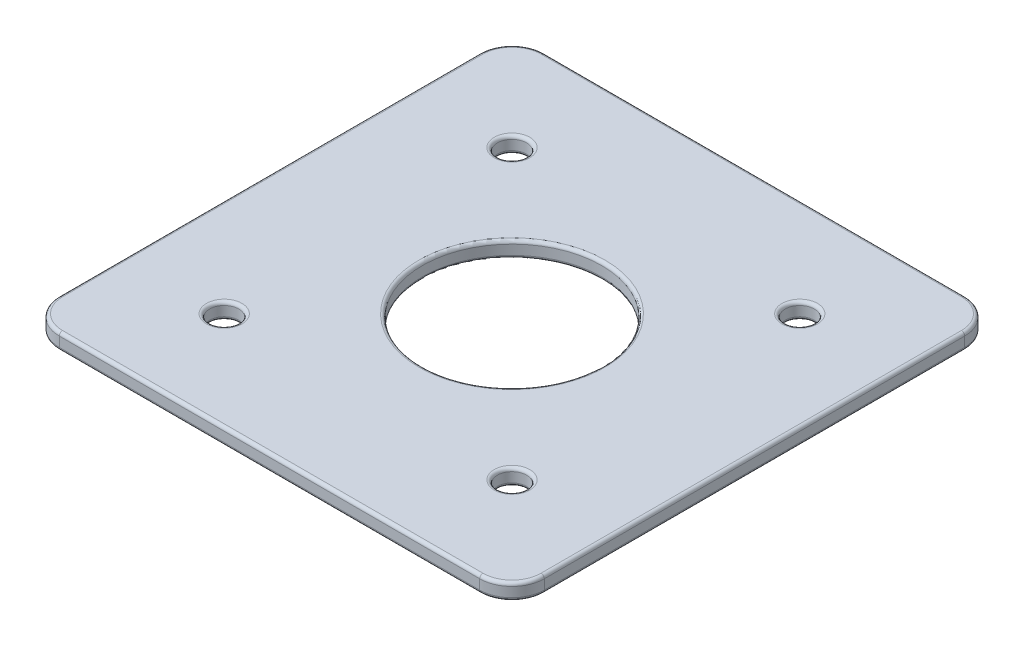
from build123d import *

# Parameters (mm, degrees)
SKETCH1_W           = 150
SKETCH1_H           = 150
SKETCH1_R           = 27.75
BOSS_EXTRUDE1_DEPTH = 5
SKETCH2_R           = 4.5
CUT_EXTRUDE1_DEPTH  = 5
FILLET1_R           = 10
FILLET2_R           = 1


with BuildPart() as part:
    # Sketch1 → Boss-Extrude1 (new body)
    with BuildSketch(Plane(origin=(0, 0, 0), x_dir=(1, 0, 0), z_dir=(0, 1, 0))):
        Rectangle(SKETCH1_W, SKETCH1_H)
        with Locations(Location((0, 0, 0), (0, 0, 270))):
            Circle(SKETCH1_R, mode=Mode.SUBTRACT)
    extrude(amount=-BOSS_EXTRUDE1_DEPTH)

    # Sketch2 → Cut-Extrude1 (cut)
    with BuildSketch(Plane(origin=(0, 0, 0), x_dir=(1, 0, 0), z_dir=(0, 1, 0))):
        with Locations(Location((44.49822974, 44.49822974, 0), (0, 0, 270))):
            Circle(SKETCH2_R)
        with Locations(Location((-44.49822974, 44.49822974, 0), (0, 0, 90))):
            Circle(SKETCH2_R)
        with Locations(Location((44.49822974, -44.49822974, 0), (0, 0, 90))):
            Circle(SKETCH2_R)
        with Locations(Location((-44.49822974, -44.49822974, 0), (0, 0, 270))):
            Circle(SKETCH2_R)
    extrude(amount=-CUT_EXTRUDE1_DEPTH, mode=Mode.SUBTRACT)

    # Fillet1
    fillet1_edges = [part.edges().sort_by_distance(p)[0] for p in [
        (75, -2.5, 75),
        (-75, -2.5, 75),
        (-75, -2.5, -75),
        (75, -2.5, -75),
    ]]
    fillet(fillet1_edges, radius=FILLET1_R)

    # Fillet2
    fillet2_edges = [part.edges().sort_by_distance(p)[0] for p in [
        (0, -5, -27.75),
        (0, 0, -27.75),
        (-44.49822974, -5, -39.99822974),
        (-44.49822974, 0, -39.99822974),
        (44.49822974, -5, 48.99822974),
        (44.49822974, 0, 48.99822974),
        (-44.49822974, -5, 39.99822974),
        (-44.49822974, 0, 39.99822974),
        (44.49822974, -5, -48.99822974),
        (44.49822974, 0, -48.99822974),
        (0, 0, -75),
        (0, -5, -75),
        (75, 0, 0),
        (-75, 0, 0),
        (0, 0, 75),
        (-72.071067812, 0, 72.071067812),
        (72.071067812, 0, 72.071067812),
        (72.071067812, 0, -72.071067812),
        (-72.071067812, 0, -72.071067812),
        (-75, -5, 0),
        (75, -5, 0),
        (0, -5, 75),
        (-72.071067812, -5, 72.071067812),
        (72.071067812, -5, 72.071067812),
        (72.071067812, -5, -72.071067812),
        (-72.071067812, -5, -72.071067812),
    ]]
    fillet(fillet2_edges, radius=FILLET2_R)


solid = part.part
